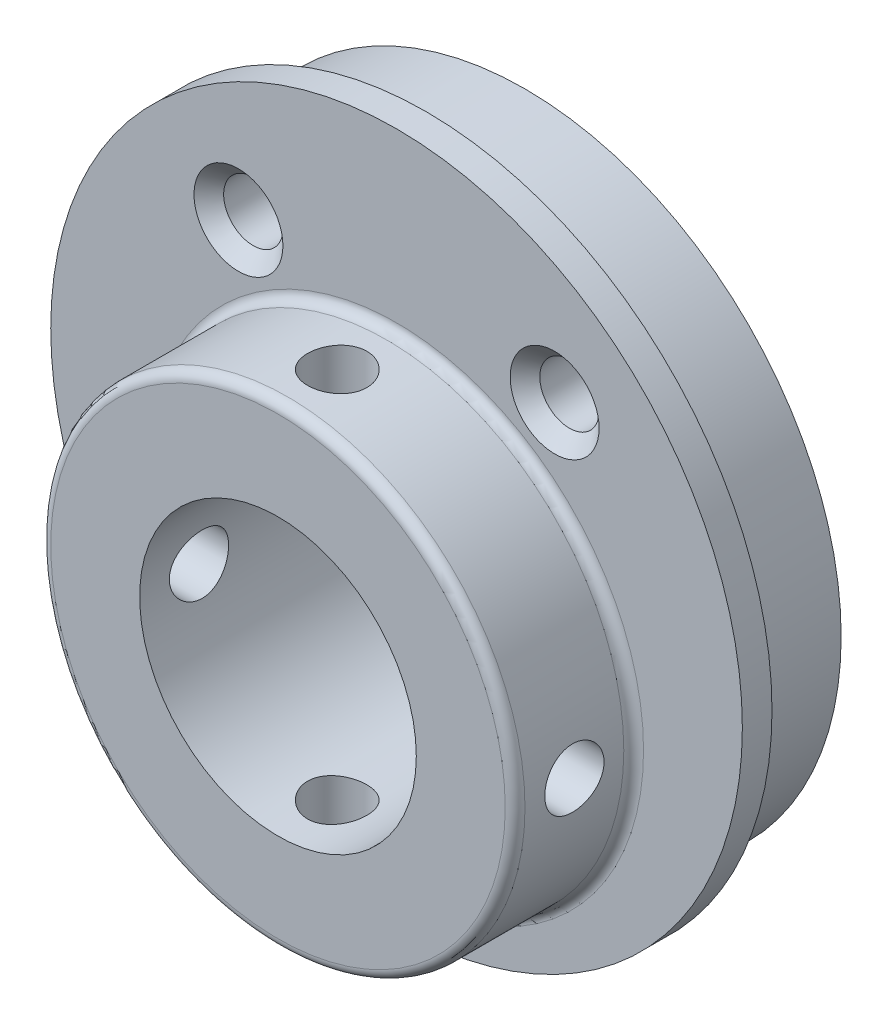
from build123d import *

# Parameters (mm, degrees)
SKETCH1_R           = 17.5
BOSS_EXTRUDE1_DEPTH = 1.5
BOSS_EXTRUDE2_START = -1.5
SKETCH2_R           = 16
BOSS_EXTRUDE2_DEPTH = 5
SKETCH3_R           = 12
BOSS_EXTRUDE3_DEPTH = 6
SKETCH4_R           = 7
CUT_EXTRUDE1_DEPTH  = 28.726341266
SKETCH5_R           = 1.5
CUT_EXTRUDE2_DEPTH  = 26.588083164
CHAMFER1_SIZE       = 0.75
FILLET1_R           = 0.5
SKETCH6_R           = 1.5
CUT_EXTRUDE3_DEPTH  = 26.860201082
CIRPATTERN1_COUNT   = 4


with BuildPart() as part:
    # Sketch1 → Boss-Extrude1 (new body)
    with BuildSketch(Plane.XY):
        Circle(SKETCH1_R)
    extrude(amount=BOSS_EXTRUDE1_DEPTH)

    # Sketch2 → Boss-Extrude2 (add)
    with BuildSketch(Plane.XY.offset(1.5).offset(BOSS_EXTRUDE2_START)):
        Circle(SKETCH2_R)
    extrude(amount=-BOSS_EXTRUDE2_DEPTH)

    # Sketch3 → Boss-Extrude3 (add)
    with BuildSketch(Plane.XY.offset(1.5)):
        with Locations((0, -3.5)):
            Circle(SKETCH3_R)
    extrude(amount=BOSS_EXTRUDE3_DEPTH)

    # Sketch4 → Cut-Extrude1 (cut, through all)
    with BuildSketch(Plane.XY.offset(7.5)):
        with Locations((0, -3.5)):
            Circle(SKETCH4_R)
    extrude(amount=-CUT_EXTRUDE1_DEPTH, mode=Mode.SUBTRACT)

    # Sketch5 → Cut-Extrude2 (cut, through all)
    with BuildSketch(Plane.XY.offset(1.5)):
        with Locations((-8, 9.5)):
            Circle(SKETCH5_R)
        with Locations((8, 9.5)):
            Circle(SKETCH5_R)
    extrude(amount=-CUT_EXTRUDE2_DEPTH, mode=Mode.SUBTRACT)

    # Chamfer1
    chamfer1_edges = [part.edges().sort_by_distance(p)[0] for p in [
        (-9.5, 9.5, 1.5),
        (6.5, 9.5, 1.5),
    ]]
    chamfer(chamfer1_edges, length=CHAMFER1_SIZE)

    # Fillet1
    fillet1_edges = [part.edges().sort_by_distance(p)[0] for p in [
        (-12, -3.5, 1.5),
        (-12, -3.5, 7.5),
    ]]
    fillet(fillet1_edges, radius=FILLET1_R)

    # Sketch6 → Cut-Extrude3 (cut, symmetric)
    with BuildSketch(Plane(origin=(0, 0, 0), x_dir=(0, 0, -1), z_dir=(1, 0, 0))):
        with Locations((-4.5, -3.5)):
            Circle(SKETCH6_R)
    cut_extrude3 = extrude(amount=CUT_EXTRUDE3_DEPTH, both=True, mode=Mode.SUBTRACT)

    # CirPattern1: Cut-Extrude3 ×4 about axis
    cirpattern1_axis = Axis((0, -3.5, 7.5), (0, 0, -1))
    for i in range(1, CIRPATTERN1_COUNT):
        add(cut_extrude3.rotate(cirpattern1_axis, i * 360 / CIRPATTERN1_COUNT), mode=Mode.SUBTRACT)


solid = part.part
